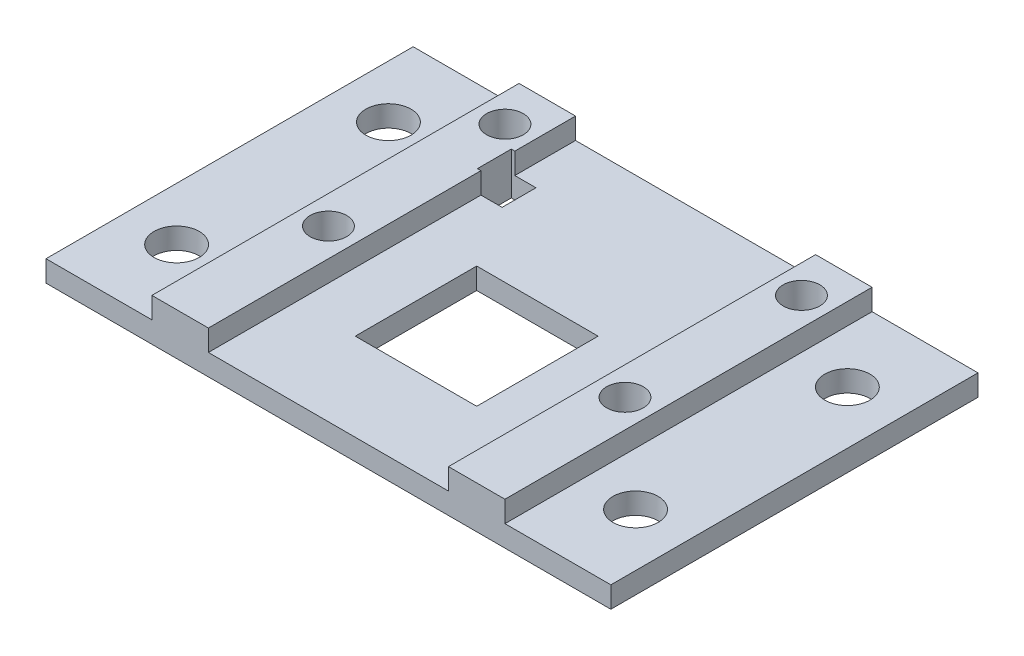
from build123d import *

# Parameters (mm, degrees)
SKETCH2_W               = 40
SKETCH2_H               = 26
SKETCH2_R               = 1.3
SKETCH2_W_2             = 8.6
SKETCH2_H_2             = 8.6
BOSS_EXTRUDE1_DEPTH     = 1.5
SKETCH3_W               = 4
SKETCH3_H               = 26
BOSS_EXTRUDE2_DEPTH     = 1.5
SKETCH5_R               = 1.3
CUT_EXTRUDE1_DEPTH      = 25.04163056
CUT_EXTRUDE3_DEPTH      = 24.900836805
CUT_EXTRUDE3_DEPTH_BACK = 24.900836805
SKETCH6_W               = 1.75
SKETCH6_H               = 2.4
SKETCH7_R               = 1.6
CUT_EXTRUDE4_DEPTH      = 2


with BuildPart() as part:
    # Sketch2 → Boss-Extrude1 (new body)
    with BuildSketch(Plane(origin=(0, 0, 0), x_dir=(1, 0, 0), z_dir=(0, 1, 0))):
        Rectangle(SKETCH2_W, SKETCH2_H)
        with Locations(Location((-10.5, -2.5, 0), (0, 0, 270))):
            Circle(SKETCH2_R, mode=Mode.SUBTRACT)
        with Locations(Location((-10.5, 10, 0), (0, 0, 270))):
            Circle(SKETCH2_R, mode=Mode.SUBTRACT)
        with Locations(Location((10.5, 10, 0), (0, 0, 270))):
            Circle(SKETCH2_R, mode=Mode.SUBTRACT)
        with Locations(Location((10.5, -2.5, 0), (0, 0, 270))):
            Circle(SKETCH2_R, mode=Mode.SUBTRACT)
        with Locations((0, -2.5)):
            Rectangle(SKETCH2_W_2, SKETCH2_H_2, mode=Mode.SUBTRACT)
    extrude(amount=BOSS_EXTRUDE1_DEPTH)

    # Sketch3 → Boss-Extrude2 (add)
    with BuildSketch(Plane(origin=(0, 1.5, 0), x_dir=(1, 0, 0), z_dir=(0, 1, 0))):
        with Locations((-10.5, 0)):
            Rectangle(SKETCH3_W, SKETCH3_H)
        with Locations((10.5, 0)):
            Rectangle(SKETCH3_W, SKETCH3_H)
    extrude(amount=BOSS_EXTRUDE2_DEPTH)

    # Sketch5 → Cut-Extrude1 (cut, through all)
    with BuildSketch(Plane.XZ):
        with Locations(Location((-10.5, 2.5, 0), (0, 0, 90))):
            Circle(SKETCH5_R)
        with Locations(Location((10.5, -10, 0), (0, 0, 270))):
            Circle(SKETCH5_R)
        with Locations(Location((10.5, 2.5, 0), (0, 0, 270))):
            Circle(SKETCH5_R)
        with Locations(Location((-10.5, -10, 0), (0, 0, 90))):
            Circle(SKETCH5_R)
    extrude(amount=-CUT_EXTRUDE1_DEPTH, mode=Mode.SUBTRACT)

    # Sketch6 → Cut-Extrude3 (cut, two sides: drawn at the far end of the back side and taken through both)
    with BuildSketch(Plane(origin=(0, 1.5, 0), x_dir=(1, 0, 0), z_dir=(0, 1, 0)).offset(-CUT_EXTRUDE3_DEPTH_BACK)):
        with Locations((-7.875, 7.5)):
            Rectangle(SKETCH6_W, SKETCH6_H)
    extrude(amount=CUT_EXTRUDE3_DEPTH + CUT_EXTRUDE3_DEPTH_BACK, mode=Mode.SUBTRACT)

    # Sketch7 → Cut-Extrude4 (cut)
    with BuildSketch(Plane(origin=(0, 1.5, 0), x_dir=(1, 0, 0), z_dir=(0, 1, 0))):
        with Locations(Location((16.25, 7.5, 0), (0, 0, 270))):
            Circle(SKETCH7_R)
        with Locations(Location((16.25, -7.5, 0), (0, 0, 270))):
            Circle(SKETCH7_R)
        with Locations(Location((-16.25, -7.5, 0), (0, 0, 270))):
            Circle(SKETCH7_R)
        with Locations(Location((-16.25, 7.5, 0), (0, 0, 270))):
            Circle(SKETCH7_R)
    extrude(amount=-CUT_EXTRUDE4_DEPTH, mode=Mode.SUBTRACT)


solid = part.part
